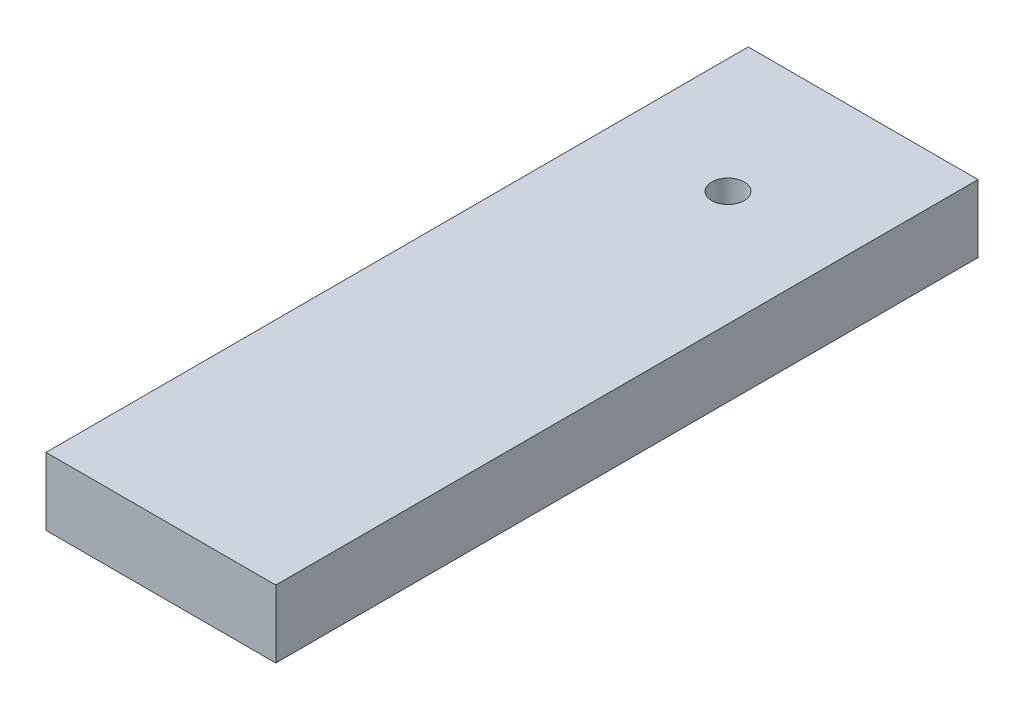
from build123d import *

# Parameters (mm, degrees)
SKETCH1_W           = 21.59
SKETCH1_H           = 81.67214734
BOSS_EXTRUDE1_DEPTH = 6.35
SKETCH2_W           = 21.59
SKETCH2_H           = 15.68610503
CUT_EXTRUDE1_DEPTH  = 6.35
SKETCH3_R           = 1.524
CUT_EXTRUDE2_DEPTH  = 6.35


with BuildPart() as part:
    # Sketch1 → Boss-Extrude1 (new body)
    with BuildSketch(Plane(origin=(0, 0, 0), x_dir=(1, 0, 0), z_dir=(0, 1, 0))):
        Rectangle(SKETCH1_W, SKETCH1_H)
    extrude(amount=BOSS_EXTRUDE1_DEPTH)

    # Sketch2 → Cut-Extrude1 (cut)
    with BuildSketch(Plane(origin=(0, 6.35, 0), x_dir=(1, 0, 0), z_dir=(0, 1, 0))):
        with Locations((0, -32.993021155)):
            Rectangle(SKETCH2_W, SKETCH2_H)
    extrude(amount=-CUT_EXTRUDE1_DEPTH, mode=Mode.SUBTRACT)

    # Sketch3 → Cut-Extrude2 (cut)
    with BuildSketch(Plane(origin=(0, 6.35, 0), x_dir=(1, 0, 0), z_dir=(0, 1, 0))):
        with Locations(Location((0, 28.13607367, 0), (0, 0, 270))):
            Circle(SKETCH3_R)
    extrude(amount=-CUT_EXTRUDE2_DEPTH, mode=Mode.SUBTRACT)


solid = part.part
